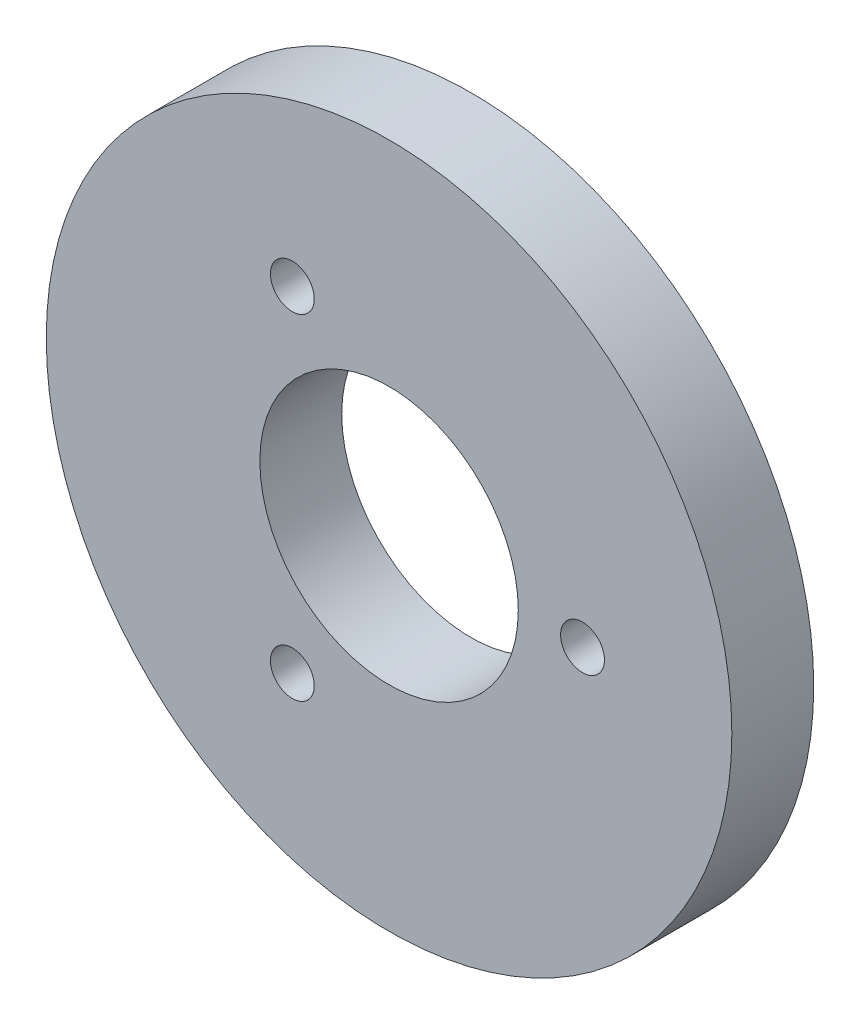
from build123d import *

# Parameters (mm, degrees)
SKETCH1_R           = 26.5811
SKETCH1_R_2         = 10.0203
SKETCH1_R_3         = 1.7
BOSS_EXTRUDE1_DEPTH = 6.35


with BuildPart() as part:
    # Sketch1 → Boss-Extrude1 (new body)
    with BuildSketch(Plane.XY):
        with Locations((107.857474429, 1.282311101)):
            Circle(SKETCH1_R)
        with Locations((107.857474429, 1.282311101)):
            Circle(SKETCH1_R_2, mode=Mode.SUBTRACT)
        with Locations((100.357474429, -11.708069956)):
            Circle(SKETCH1_R_3, mode=Mode.SUBTRACT)
        with Locations((122.857474429, 1.282311101)):
            Circle(SKETCH1_R_3, mode=Mode.SUBTRACT)
        with Locations((100.357474429, 14.272692158)):
            Circle(SKETCH1_R_3, mode=Mode.SUBTRACT)
    extrude(amount=BOSS_EXTRUDE1_DEPTH)


solid = part.part
